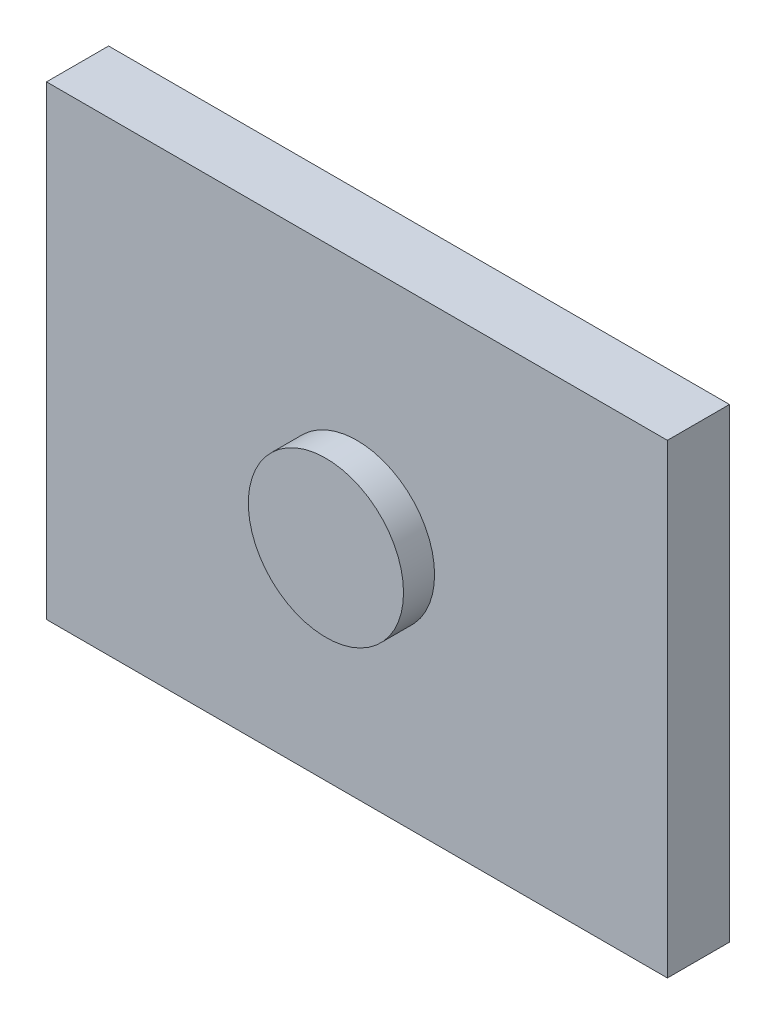
from build123d import *

# Parameters (mm, degrees)
SKETCH1_W           = 200
SKETCH1_H           = 150
BOSS_EXTRUDE1_DEPTH = 20
SKETCH2_R           = 25
BOSS_EXTRUDE2_DEPTH = 10


with BuildPart() as part:
    # Sketch1 → Boss-Extrude1 (new body)
    with BuildSketch(Plane.XY):
        Rectangle(SKETCH1_W, SKETCH1_H)
    extrude(amount=BOSS_EXTRUDE1_DEPTH)

    # Sketch2 → Boss-Extrude2 (add)
    with BuildSketch(Plane.XY.offset(20)):
        Circle(SKETCH2_R)
    extrude(amount=BOSS_EXTRUDE2_DEPTH)


solid = part.part
